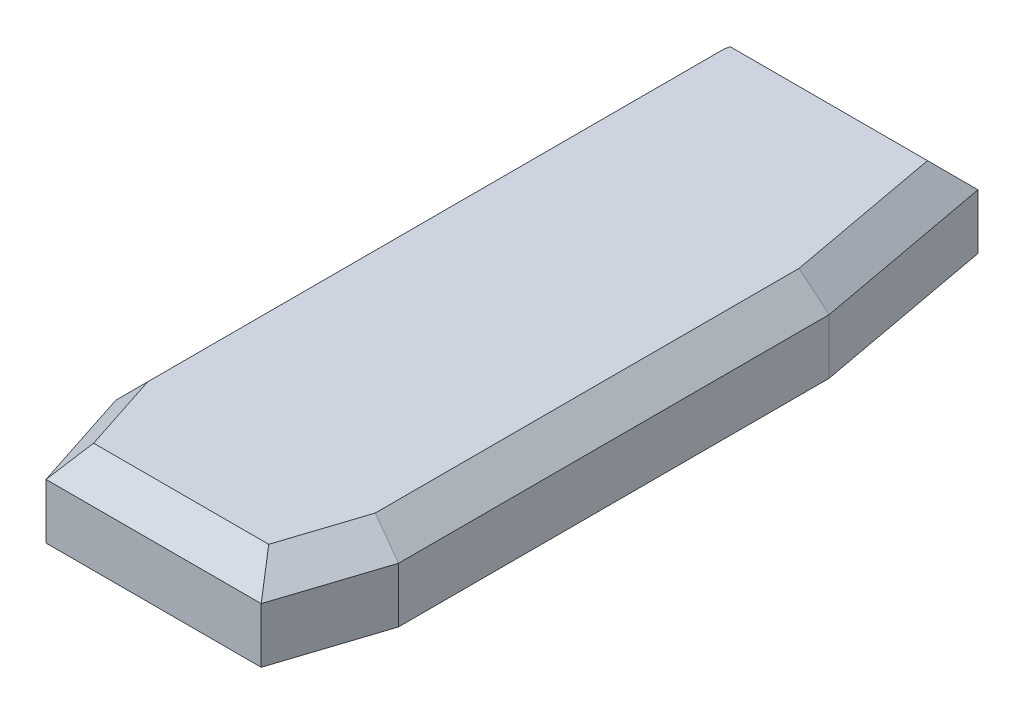
from build123d import *

# Parameters (mm, degrees)
EXTRUDE_1_DEPTH = 6
CHAMFER_1_SIZE  = 2


with BuildPart() as part:
    # Эскиз1 → Бобышка-Вытянуть1 (new body)
    with BuildSketch(Plane(origin=(0, 0, 0), x_dir=(1, 0, 0), z_dir=(0, 1, 0))):
        Polygon((-2.444490443, 0), (-18.055509557, 0), (-20.5, 7.510567106), (-20.5, 38.754932475), (-18.055509557, 52), (-2.444490443, 52), (0, 38.754932475), (0, 7.510567106), align=None)
    extrude(amount=EXTRUDE_1_DEPTH)

    # Фаска1
    chamfer_1_edges = [part.edges().sort_by_distance(p)[0] for p in [
        (-19.277754779, 6, -3.755283553),
        (-10.25, 6, 0),
        (-1.222245221, 6, -3.755283553),
        (0, 6, -23.13274979),
        (-1.222245221, 6, -45.377466237),
        (-10.25, 6, -52),
        (-20.5, 6, -23.13274979),
    ]]
    chamfer(chamfer_1_edges, length=CHAMFER_1_SIZE)


solid = part.part
